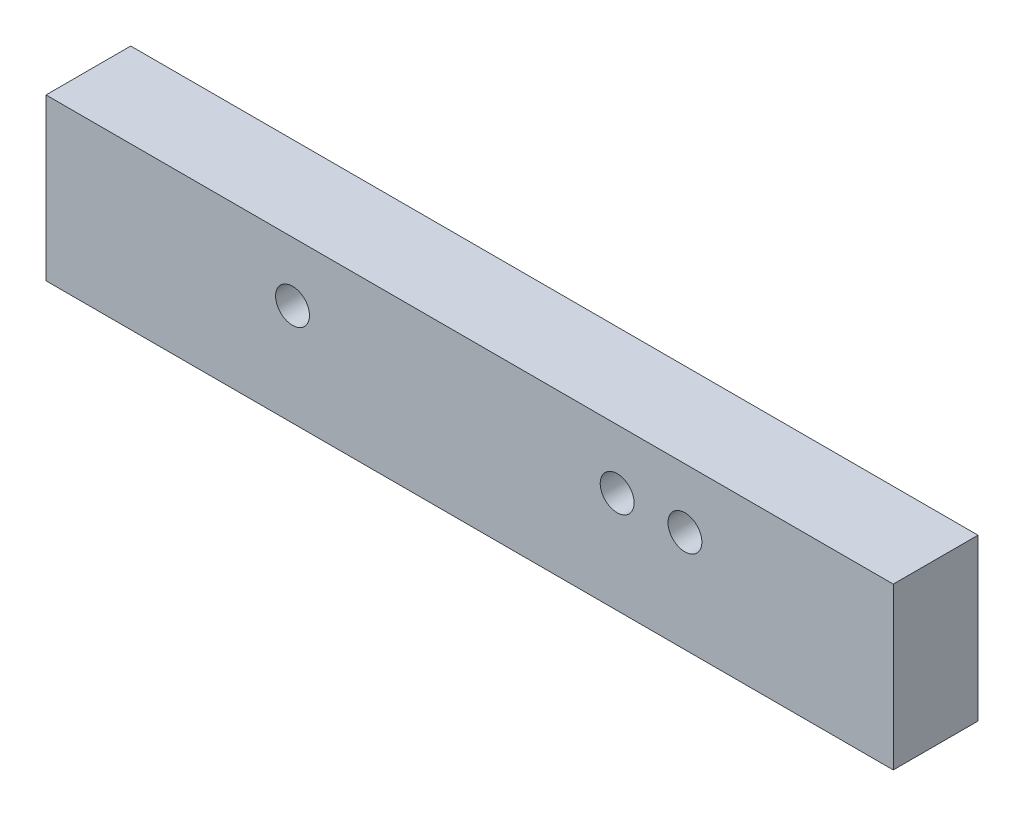
from build123d import *

# Parameters (mm, degrees)
SKETCH1_W           = 50
SKETCH1_H           = 5
BOSS_EXTRUDE1_DEPTH = 9.5
CUT_EXTRUDE1_REACH  = 35.869
SKETCH2_R           = 1


with BuildPart() as part:
    # Sketch1 → Boss-Extrude1 (new body)
    with BuildSketch(Plane(origin=(0, 10, 0), x_dir=(1, 0, 0), z_dir=(0, 1, 0))):
        with Locations((2.237632925, -48.5)):
            Rectangle(SKETCH1_W, SKETCH1_H)
    extrude(amount=BOSS_EXTRUDE1_DEPTH)

    # Sketch2 → Cut-Extrude1 (cut, up to next)
    with BuildSketch(Plane(origin=(0, 0, 46), x_dir=(-1, 0, 0), z_dir=(0, 0, -1)), mode=Mode.PRIVATE) as cut_extrude1_sk1:
        with Locations((-14.942868758, 16)):
            Circle(SKETCH2_R)
    cut_extrude1_tool1 = extrude(cut_extrude1_sk1.sketch, amount=-CUT_EXTRUDE1_REACH, mode=Mode.PRIVATE) & part.part
    # Sketch2 → Cut-Extrude1 (cut, up to next)
    with BuildSketch(Plane(origin=(0, 0, 46), x_dir=(-1, 0, 0), z_dir=(0, 0, -1)), mode=Mode.PRIVATE) as cut_extrude1_sk2:
        with Locations((8.213561031, 16)):
            Circle(SKETCH2_R)
    cut_extrude1_tool2 = extrude(cut_extrude1_sk2.sketch, amount=-CUT_EXTRUDE1_REACH, mode=Mode.PRIVATE) & part.part
    # Sketch2 → Cut-Extrude1 (cut, up to next)
    with BuildSketch(Plane(origin=(0, 0, 46), x_dir=(-1, 0, 0), z_dir=(0, 0, -1)), mode=Mode.PRIVATE) as cut_extrude1_sk3:
        with Locations((-10.942868758, 16)):
            Circle(SKETCH2_R)
    cut_extrude1_tool3 = extrude(cut_extrude1_sk3.sketch, amount=-CUT_EXTRUDE1_REACH, mode=Mode.PRIVATE) & part.part
    add(cut_extrude1_tool1.solids().sort_by_distance((14.942869, 16, 46))[0], mode=Mode.SUBTRACT)
    add(cut_extrude1_tool2.solids().sort_by_distance((-8.213561, 16, 46))[0], mode=Mode.SUBTRACT)
    add(cut_extrude1_tool3.solids().sort_by_distance((10.942869, 16, 46))[0], mode=Mode.SUBTRACT)


solid = part.part
